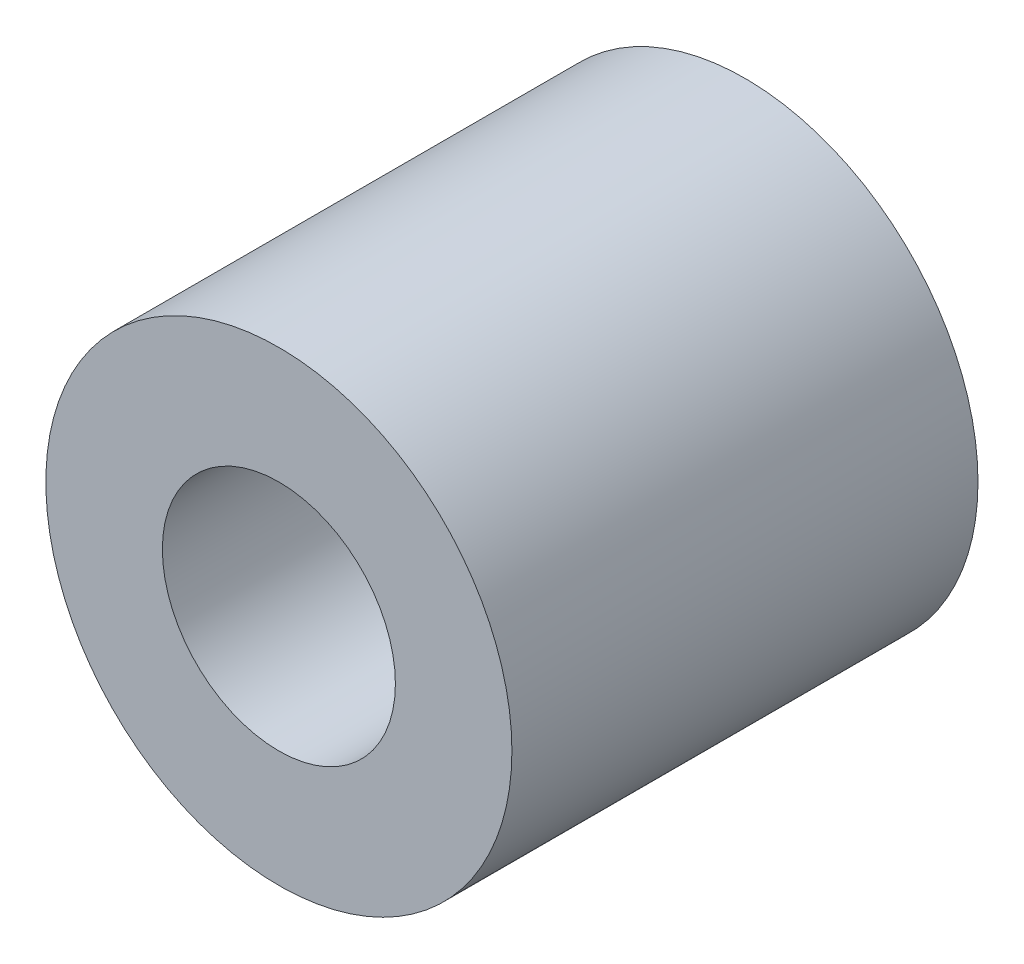
from build123d import *

# Parameters (mm, degrees)
SKETCH2_R   = 3
SKETCH2_R_2 = 1.5


with BuildPart() as part:
    # Sweep1: sweep along a path in Sketch1
    with BuildLine(Plane(origin=(0, 0, 0), x_dir=(1, 0, 0), z_dir=(0, 1, 0))) as sweep1_path:
        Line((0, 0), (0, -6))
    # Sketch2 → Sweep1 (sweep)
    with BuildSketch(Plane.XY.offset(6)):
        Circle(SKETCH2_R)
        Circle(SKETCH2_R_2, mode=Mode.SUBTRACT)
    sweep(path=sweep1_path.line)


solid = part.part
